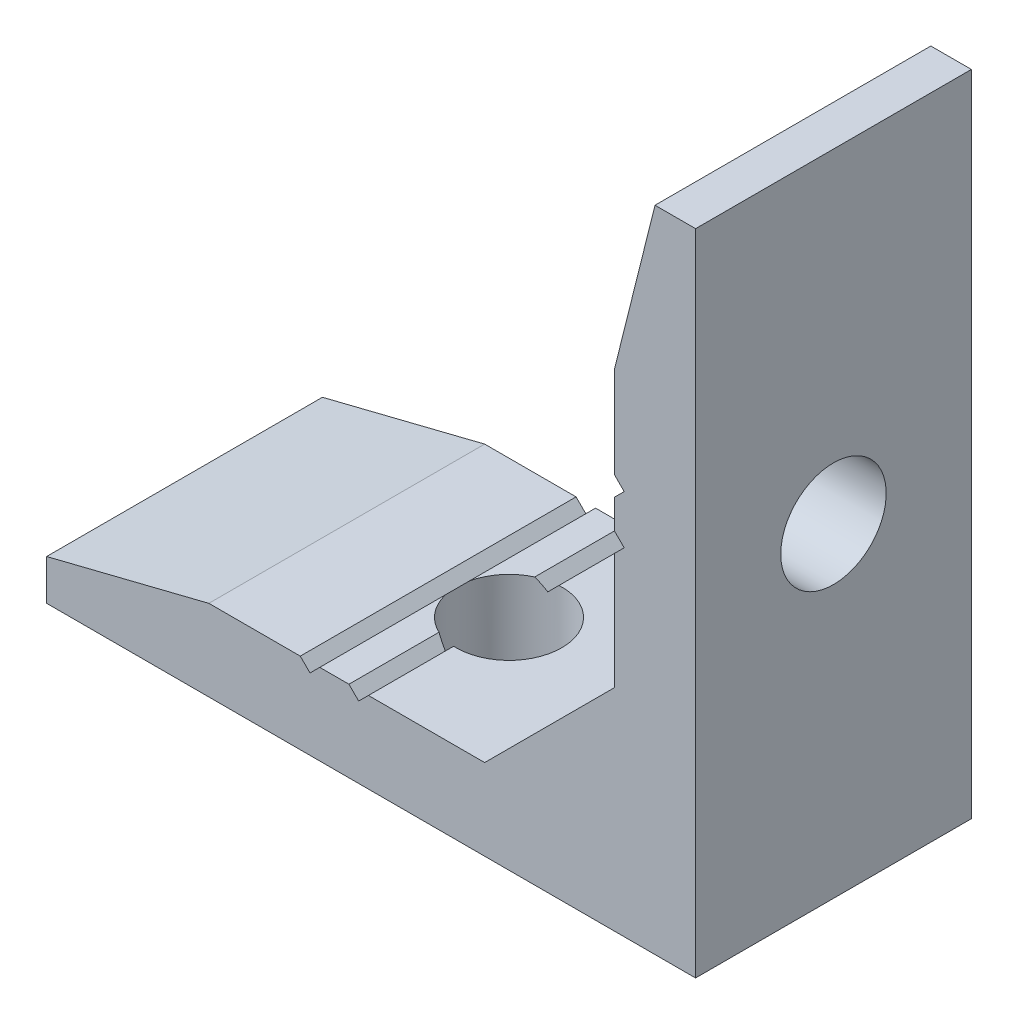
from build123d import *

# Parameters (mm, degrees)
EXTRUDE_1_DEPTH     = 8.5
SKETCH_3_R          = 3.25
CUT_EXTRUDE_1_DEPTH = 54.826108906
SKETCH_4_R          = 3.25
CUT_EXTRUDE_2_DEPTH = 54.826108906


with BuildPart() as part:
    # 草图1 → 凸台-拉伸1 (new, symmetric)
    with BuildSketch(Plane.XY):
        Polygon((0, 0), (40, 0), (40, 40), (37.5, 40), (35, 30), (35, 24.364950833), (35.6, 23.764950833), (35, 23.164950833), (35, 21.364950833), (35.6, 20.764950833), (35, 20.164950833), (35, 13), (27, 5), (19.835049167, 5), (19.235049167, 4.4), (18.635049167, 5), (16.835049167, 5), (16.235049167, 4.4), (15.635049167, 5), (10, 5), (0, 2.5), align=None)
    extrude(amount=EXTRUDE_1_DEPTH, both=True)

    # 草图3 → 切除-拉伸1 (cut, through all)
    with BuildSketch(Plane(origin=(0, 5, 0), x_dir=(1, 0, 0), z_dir=(0, 1, 0))):
        with Locations(Location((20, 0, 0), (0, 0, 270))):
            Circle(SKETCH_3_R)
    extrude(amount=-CUT_EXTRUDE_1_DEPTH, mode=Mode.SUBTRACT)

    # 草图4 → 切除-拉伸2 (cut, through all)
    with BuildSketch(Plane.ZY.offset(-35)):
        with Locations((0, 20)):
            Circle(SKETCH_4_R)
    extrude(amount=-CUT_EXTRUDE_2_DEPTH, mode=Mode.SUBTRACT)


solid = part.part
